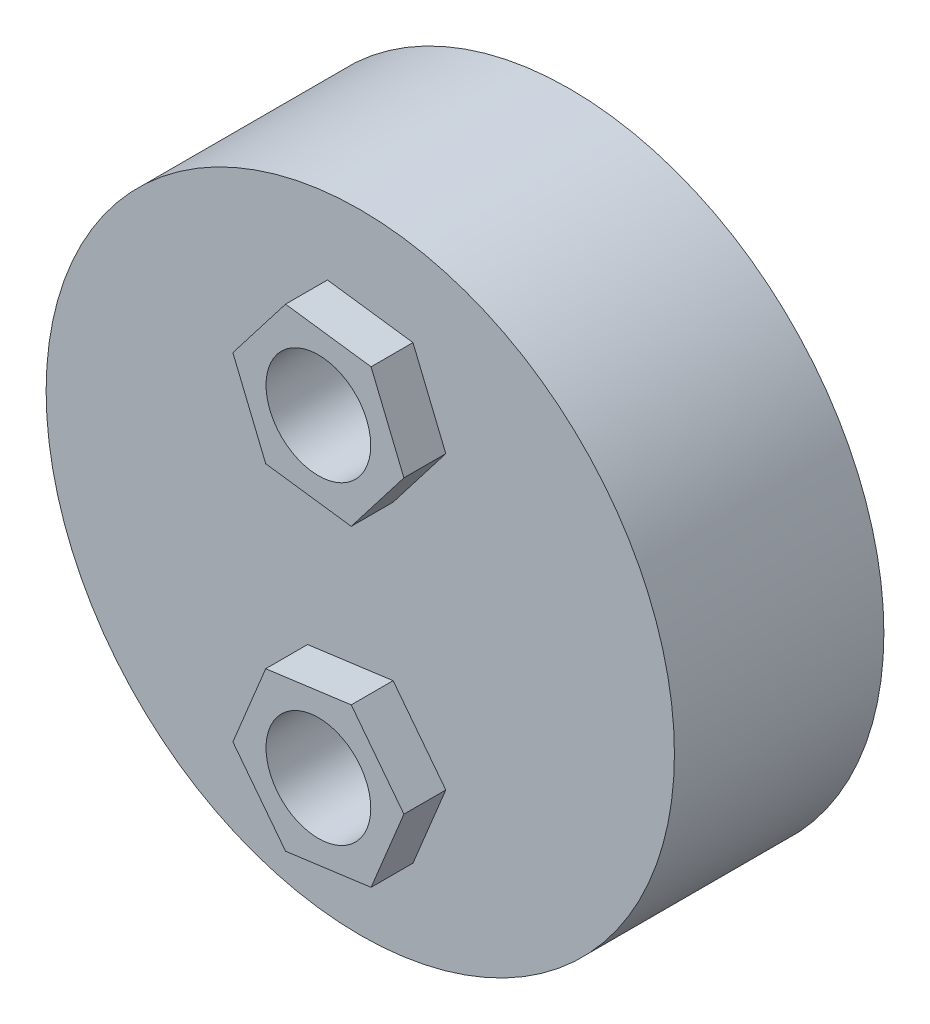
from build123d import *

# Parameters (mm, degrees)
IZIM1_R                     = 15
Y_KSEKLIK_EKSTR_ZYON1_DEPTH = 10
IZIM2_R                     = 2.5
KES_EKSTR_ZYON1_DEPTH       = 5
Y_KSEKLIK_EKSTR_ZYON3_START = 2
IZIM3_R                     = 2.5
Y_KSEKLIK_EKSTR_ZYON3_DEPTH = 2


with BuildPart() as part:
    # Çizim1 → Yükseklik-Ekstrüzyon1 (new body)
    with BuildSketch(Plane.XY):
        Circle(IZIM1_R)
    extrude(amount=Y_KSEKLIK_EKSTR_ZYON1_DEPTH)

    # Çizim2 → Kes-Ekstrüzyon1 (cut)
    with BuildSketch(Plane.XY.offset(10)):
        with Locations((0, 7.5)):
            Circle(IZIM2_R)
        with Locations((0, -7.5)):
            Circle(IZIM2_R)
    extrude(amount=-KES_EKSTR_ZYON1_DEPTH, mode=Mode.SUBTRACT)

    # Çizim3 → Yükseklik-Ekstrüzyon3 (add)
    # profile 1 of 2: a face of its own
    with BuildSketch(Plane.XY.offset(10).offset(Y_KSEKLIK_EKSTR_ZYON3_START)):
        Polygon((-4.083040029, 8.04725253), (-2.515454607, 4.237609875), (1.567585421, 3.690357346), (4.083040029, 6.95274747), (2.515454607, 10.762390125), (-1.567585421, 11.309642654), align=None)
        with Locations((0, 7.5)):
            Circle(IZIM3_R, mode=Mode.SUBTRACT)
    # profile 2 of 2: a face of its own
    with BuildSketch(Plane.XY.offset(10).offset(Y_KSEKLIK_EKSTR_ZYON3_START)):
        Polygon((1.567585421, -3.690357346), (4.083040029, -6.95274747), (2.515454607, -10.762390125), (-1.567585421, -11.309642654), (-4.083040029, -8.04725253), (-2.515454607, -4.237609875), align=None)
        with Locations((0, -7.5)):
            Circle(IZIM3_R, mode=Mode.SUBTRACT)
    extrude(amount=-Y_KSEKLIK_EKSTR_ZYON3_DEPTH)


solid = part.part
